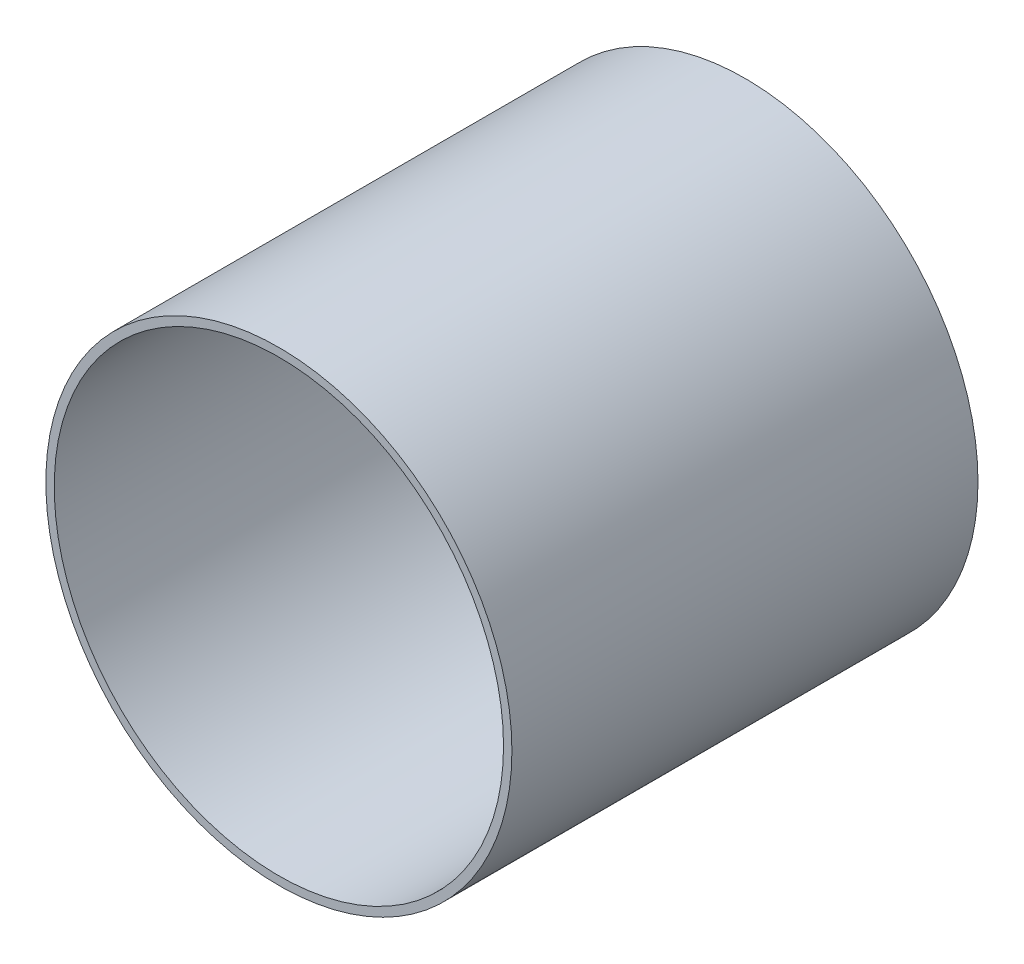
from build123d import *

# Parameters (mm, degrees)
SKETCH1_R           = 12.5
SKETCH1_R_2         = 12.05
BOSS_EXTRUDE1_DEPTH = 25


with BuildPart() as part:
    # Sketch1 → Boss-Extrude1 (new body)
    with BuildSketch(Plane.XY):
        Circle(SKETCH1_R)
        Circle(SKETCH1_R_2, mode=Mode.SUBTRACT)
    extrude(amount=BOSS_EXTRUDE1_DEPTH)


solid = part.part
